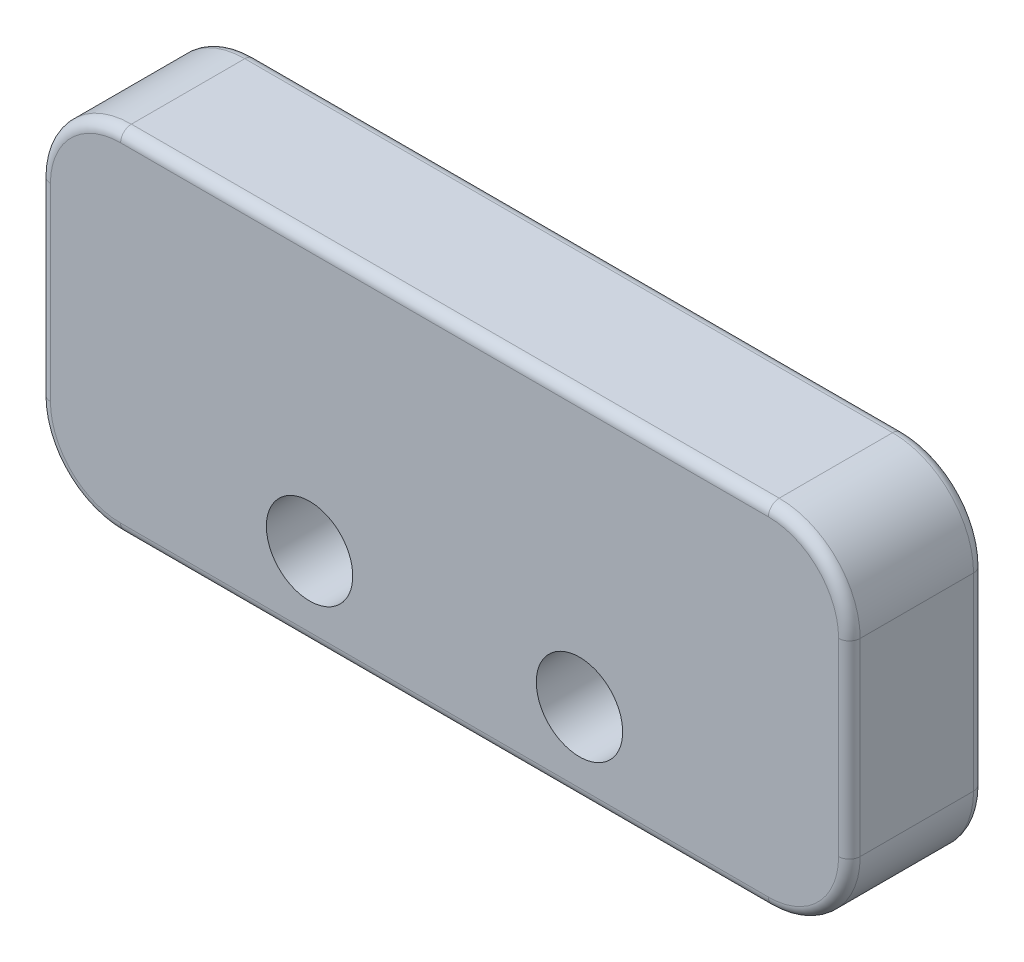
from build123d import *

# Parameters (mm, degrees)
SKETCH1_W           = 30
SKETCH1_H           = 13
BOSS_EXTRUDE1_DEPTH = 5
SKETCH2_R           = 1.6
CUT_EXTRUDE1_DEPTH  = 34.075670817
FILLET1_R           = 3
FILLET2_R           = 0.4


with BuildPart() as part:
    # Sketch1 → Boss-Extrude1 (new body)
    with BuildSketch(Plane.XY):
        with Locations((15, -6.5)):
            Rectangle(SKETCH1_W, SKETCH1_H)
    extrude(amount=BOSS_EXTRUDE1_DEPTH)

    # Sketch2 → Cut-Extrude1 (cut, through all)
    with BuildSketch(Plane(origin=(0, 0, 0), x_dir=(-1, 0, 0), z_dir=(0, 0, -1))):
        with Locations((-20, -10)):
            Circle(SKETCH2_R)
        with Locations((-10, -10)):
            Circle(SKETCH2_R)
    extrude(amount=-CUT_EXTRUDE1_DEPTH, mode=Mode.SUBTRACT)

    # Fillet1
    fillet1_edges = [part.edges().sort_by_distance(p)[0] for p in [
        (0, 0, 2.5),
        (30, 0, 2.5),
        (30, -13, 2.5),
        (0, -13, 2.5),
    ]]
    fillet(fillet1_edges, radius=FILLET1_R)

    # Fillet2
    fillet2_edges = [part.edges().sort_by_distance(p)[0] for p in [
        (0, -6.5, 0),
        (0, -6.5, 5),
        (15, 0, 0),
        (30, -6.5, 0),
        (15, -13, 0),
        (29.121320344, -0.878679656, 0),
        (29.121320344, -12.121320344, 0),
        (0.878679656, -12.121320344, 0),
        (0.878679656, -0.878679656, 0),
        (15, 0, 5),
        (15, -13, 5),
        (30, -6.5, 5),
        (29.121320344, -0.878679656, 5),
        (29.121320344, -12.121320344, 5),
        (0.878679656, -12.121320344, 5),
        (0.878679656, -0.878679656, 5),
    ]]
    fillet(fillet2_edges, radius=FILLET2_R)


solid = part.part
